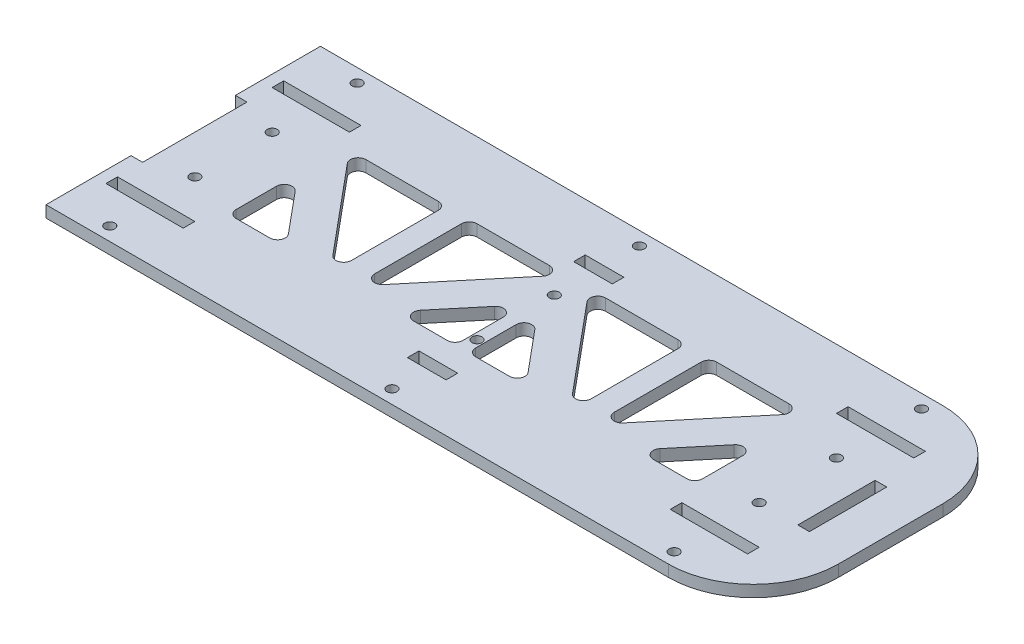
from build123d import *

# Parameters (mm, degrees)
SKETCH1_W            = 300
SKETCH1_H            = 213
BOSS_EXTRUDE1_DEPTH  = 3
SKETCH2_W            = 3
SKETCH2_H            = 21
CUT_EXTRUDE1_DEPTH   = 184.987091939
SKETCH3_W            = 20
SKETCH3_H            = 3
SKETCH3_W_2          = 10
CUT_EXTRUDE2_DEPTH   = 184.987091939
SKETCH4_W            = 3
SKETCH4_H            = 20
CUT_EXTRUDE3_DEPTH   = 184.987091939
SKETCH6_R            = 1.3
CUT_EXTRUDE4_DEPTH   = 184.987091939
CUT_EXTRUDE5_DEPTH   = 184.987091939
FILLET1_R            = 4
FILLET1_OF_MIRROR1_R = 4
SKETCH8_R            = 1.3
CUT_EXTRUDE6_DEPTH   = 184.987091939
CUT_EXTRUDE7_DEPTH   = 184.987091939
CUT_EXTRUDE8_DEPTH   = 157.208994619
FILLET2_R            = 2
SKETCH11_W           = 183
SKETCH11_H           = 8
CUT_EXTRUDE9_DEPTH   = 157.208994619
FILLET3_R            = 22


with BuildPart() as part:
    # Sketch1 → Boss-Extrude1 (new body)
    with BuildSketch(Plane(origin=(0, 0, 0), x_dir=(1, 0, 0), z_dir=(0, 1, 0))):
        Rectangle(SKETCH1_W, SKETCH1_H)
    extrude(amount=BOSS_EXTRUDE1_DEPTH)

    # Sketch2 → Cut-Extrude1 (cut, through all)
    with BuildSketch(Plane(origin=(0, 3, 0), x_dir=(1, 0, 0), z_dir=(0, 1, 0))):
        with Locations((-148.5, 96)):
            Rectangle(SKETCH2_W, SKETCH2_H)
        Polygon((-150, -13.5), (-150, 0), (-150, 13.5), (-147, 13.5), (-147, -13.5), align=None)
        with Locations((-148.5, 54)):
            Rectangle(SKETCH2_W, SKETCH2_H)
        with Locations((-148.5, -54)):
            Rectangle(SKETCH2_W, SKETCH2_H)
        with Locations((-148.5, -96)):
            Rectangle(SKETCH2_W, SKETCH2_H)
    extrude(amount=-CUT_EXTRUDE1_DEPTH, mode=Mode.SUBTRACT)

    # Sketch3 → Cut-Extrude2 (cut, through all)
    with BuildSketch(Plane(origin=(0, 3, 0), x_dir=(1, 0, 0), z_dir=(0, 1, 0))):
        with Locations((-137, 21.5)):
            Rectangle(SKETCH3_W, SKETCH3_H)
        with Locations((-64, 21.5)):
            Rectangle(SKETCH3_W_2, SKETCH3_H)
        with Locations((9, 21.5)):
            Rectangle(SKETCH3_W, SKETCH3_H)
        with Locations((9, -21.5)):
            Rectangle(SKETCH3_W, SKETCH3_H)
        with Locations((-64, -21.5)):
            Rectangle(SKETCH3_W_2, SKETCH3_H)
        with Locations((-137, -21.5)):
            Rectangle(SKETCH3_W, SKETCH3_H)
    extrude(amount=-CUT_EXTRUDE2_DEPTH, mode=Mode.SUBTRACT)

    # Sketch4 → Cut-Extrude3 (cut, through all)
    with BuildSketch(Plane(origin=(0, 3, 0), x_dir=(1, 0, 0), z_dir=(0, 1, 0))):
        with Locations((20.5, 0)):
            Rectangle(SKETCH4_W, SKETCH4_H)
    extrude(amount=-CUT_EXTRUDE3_DEPTH, mode=Mode.SUBTRACT)

    # Sketch6 → Cut-Extrude4 (cut, through all)
    with BuildSketch(Plane(origin=(0, 3, 0), x_dir=(1, 0, 0), z_dir=(0, 1, 0))):
        with Locations(Location((-137, 32, 0), (0, 0, 270))):
            Circle(SKETCH6_R)
        with Locations(Location((-64, 32, 0), (0, 0, 270))):
            Circle(SKETCH6_R)
        with Locations(Location((9, 32, 0), (0, 0, 270))):
            Circle(SKETCH6_R)
        with Locations(Location((9, -32, 0), (0, 0, 270))):
            Circle(SKETCH6_R)
        with Locations(Location((-64, -32, 0), (0, 0, 270))):
            Circle(SKETCH6_R)
        with Locations(Location((-137, -32, 0), (0, 0, 270))):
            Circle(SKETCH6_R)
    extrude(amount=-CUT_EXTRUDE4_DEPTH, mode=Mode.SUBTRACT)

    # Sketch7 → Cut-Extrude5 (cut, through all)
    with BuildSketch(Plane(origin=(0, 3, 0), x_dir=(1, 0, 0), z_dir=(0, 1, 0))):
        Polygon((-115, 90), (-115, 60), (-85, 60), align=None)
        Polygon((-108, 90), (-78, 60), (-78, 90), align=None)
        Polygon((-64, 90), (-34, 90), (-64, 60), align=None)
        Polygon((-27, 60), (-57, 60), (-27, 90), align=None)
        Polygon((-15, 90), (-15, 60), (15, 60), align=None)
        Polygon((-8, 90), (22, 60), (22, 90), align=None)
        Polygon((36, 90), (66, 90), (36, 60), align=None)
        Polygon((73, 60), (43, 60), (73, 90), align=None)
        Polygon((85, 90), (85, 60), (115, 60), align=None)
        Polygon((92, 90), (122, 60), (122, 90), align=None)
    cut_extrude5 = extrude(amount=-CUT_EXTRUDE5_DEPTH, mode=Mode.SUBTRACT)

    # Fillet1
    fillet1_edges = [part.edges().sort_by_distance(p)[0] for p in [
        (-115, 1.5, -90),
        (-85, 1.5, -60),
        (-115, 1.5, -60),
        (-8, 1.5, -90),
        (22, 1.5, -90),
        (22, 1.5, -60),
        (36, 1.5, -60),
        (36, 1.5, -90),
        (66, 1.5, -90),
        (73, 1.5, -90),
        (73, 1.5, -60),
        (43, 1.5, -60),
        (92, 1.5, -90),
        (122, 1.5, -90),
        (122, 1.5, -60),
        (85, 1.5, -90),
        (115, 1.5, -60),
        (85, 1.5, -60),
        (-108, 1.5, -90),
        (-78, 1.5, -90),
        (-78, 1.5, -60),
        (-64, 1.5, -60),
        (-64, 1.5, -90),
        (-34, 1.5, -90),
        (-27, 1.5, -90),
        (-27, 1.5, -60),
        (-57, 1.5, -60),
        (-15, 1.5, -90),
        (15, 1.5, -60),
        (-15, 1.5, -60),
    ]]
    fillet(fillet1_edges, radius=FILLET1_R)

    # Mirror1: Cut-Extrude5 across plane
    add(cut_extrude5.mirror(Plane.XY), mode=Mode.SUBTRACT)

    # Fillet1 of Mirror1
    fillet1_of_mirror1_edges = [part.edges().sort_by_distance(p)[0] for p in [
        (-115, 1.5, 90),
        (-85, 1.5, 60),
        (-115, 1.5, 60),
        (-8, 1.5, 90),
        (22, 1.5, 90),
        (22, 1.5, 60),
        (36, 1.5, 60),
        (36, 1.5, 90),
        (66, 1.5, 90),
        (73, 1.5, 90),
        (73, 1.5, 60),
        (43, 1.5, 60),
        (92, 1.5, 90),
        (122, 1.5, 90),
        (122, 1.5, 60),
        (85, 1.5, 90),
        (115, 1.5, 60),
        (85, 1.5, 60),
        (-108, 1.5, 90),
        (-78, 1.5, 90),
        (-78, 1.5, 60),
        (-64, 1.5, 60),
        (-64, 1.5, 90),
        (-34, 1.5, 90),
        (-27, 1.5, 90),
        (-27, 1.5, 60),
        (-57, 1.5, 60),
        (-15, 1.5, 90),
        (15, 1.5, 60),
        (-15, 1.5, 60),
    ]]
    fillet(fillet1_of_mirror1_edges, radius=FILLET1_OF_MIRROR1_R)

    # Sketch8 → Cut-Extrude6 (cut, through all)
    with BuildSketch(Plane(origin=(0, 3, 0), x_dir=(1, 0, 0), z_dir=(0, 1, 0))):
        with Locations(Location((-136.98744233, -10, 0), (0, 0, 270))):
            Circle(SKETCH8_R)
        with Locations(Location((-64, -10, 0), (0, 0, 270))):
            Circle(SKETCH8_R)
        with Locations(Location((9, -10, 0), (0, 0, 270))):
            Circle(SKETCH8_R)
        with Locations(Location((-136.98744233, 10, 0), (0, 0, 90))):
            Circle(SKETCH8_R)
        with Locations(Location((-64, 10, 0), (0, 0, 90))):
            Circle(SKETCH8_R)
        with Locations(Location((9, 10, 0), (0, 0, 90))):
            Circle(SKETCH8_R)
    extrude(amount=-CUT_EXTRUDE6_DEPTH, mode=Mode.SUBTRACT)

    # Sketch9 → Cut-Extrude7 (cut, through all)
    with BuildSketch(Plane(origin=(0, 3, 0), x_dir=(1, 0, 0), z_dir=(0, 1, 0))):
        Polygon((-147, 43.5), (33, 43.5), (33, -43.5), (-147, -43.5), (-187.25008624, -43.5), (-187.25008624, -148.565138747), (177.736932827, -148.565138747), (177.736932827, 142.910410283), (-187.25008624, 142.910410283), (-187.25008624, 43.5), align=None)
    extrude(amount=-CUT_EXTRUDE7_DEPTH, mode=Mode.SUBTRACT)

    # Sketch10 → Cut-Extrude8 (cut, through all)
    with BuildSketch(Plane(origin=(0, 3, 0), x_dir=(1, 0, 0), z_dir=(0, 1, 0))):
        Polygon((-123, 16), (-98, 16), (-98, -14), align=None)
        Polygon((-92, 16), (-92, -14), (-67, 16), align=None)
        Polygon((-124.333333333, 4), (-124.333333333, -14), (-109.333333333, -14), align=None)
        Polygon((-80.666666667, -14), (-65.666666667, 4), (-65.666666667, -14), align=None)
        Polygon((-62.333333333, 4), (-62.333333333, -14), (-47.333333333, -14), align=None)
        Polygon((-18.666666667, -14), (-3.666666667, 4), (-3.666666667, -14), align=None)
        Polygon((-61, 16), (-36, 16), (-36, -14), align=None)
        Polygon((-30, -14), (-5, 16), (-30, 16), align=None)
    extrude(amount=-CUT_EXTRUDE8_DEPTH, mode=Mode.SUBTRACT)

    # Fillet2
    fillet2_edges = [part.edges().sort_by_distance(p)[0] for p in [
        (-98, 1.5, 14),
        (-123, 1.5, -16),
        (-98, 1.5, -16),
        (-65.666666667, 1.5, 14),
        (-80.666666667, 1.5, 14),
        (-65.666666667, 1.5, -4),
        (-124.333333333, 1.5, -4),
        (-109.333333333, 1.5, 14),
        (-124.333333333, 1.5, 14),
        (-92, 1.5, -16),
        (-67, 1.5, -16),
        (-92, 1.5, 14),
        (-30, 1.5, 14),
        (-30, 1.5, -16),
        (-5, 1.5, -16),
        (-36, 1.5, 14),
        (-61, 1.5, -16),
        (-36, 1.5, -16),
        (-3.666666667, 1.5, 14),
        (-18.666666667, 1.5, 14),
        (-3.666666667, 1.5, -4),
        (-62.333333333, 1.5, -4),
        (-47.333333333, 1.5, 14),
        (-62.333333333, 1.5, 14),
    ]]
    fillet(fillet2_edges, radius=FILLET2_R)

    # Sketch11 → Cut-Extrude9 (cut, through all)
    with BuildSketch(Plane(origin=(0, 3, 0), x_dir=(1, 0, 0), z_dir=(0, 1, 0))):
        with Locations((-58.5, 39.5)):
            Rectangle(SKETCH11_W, SKETCH11_H)
        with Locations((-58.5, -39.5)):
            Rectangle(SKETCH11_W, SKETCH11_H)
    extrude(amount=-CUT_EXTRUDE9_DEPTH, mode=Mode.SUBTRACT)

    # Fillet3
    fillet3_edges = [part.edges().sort_by_distance(p)[0] for p in [
        (33, 1.5, -35.5),
        (33, 1.5, 35.5),
    ]]
    fillet(fillet3_edges, radius=FILLET3_R)


solid = part.part
